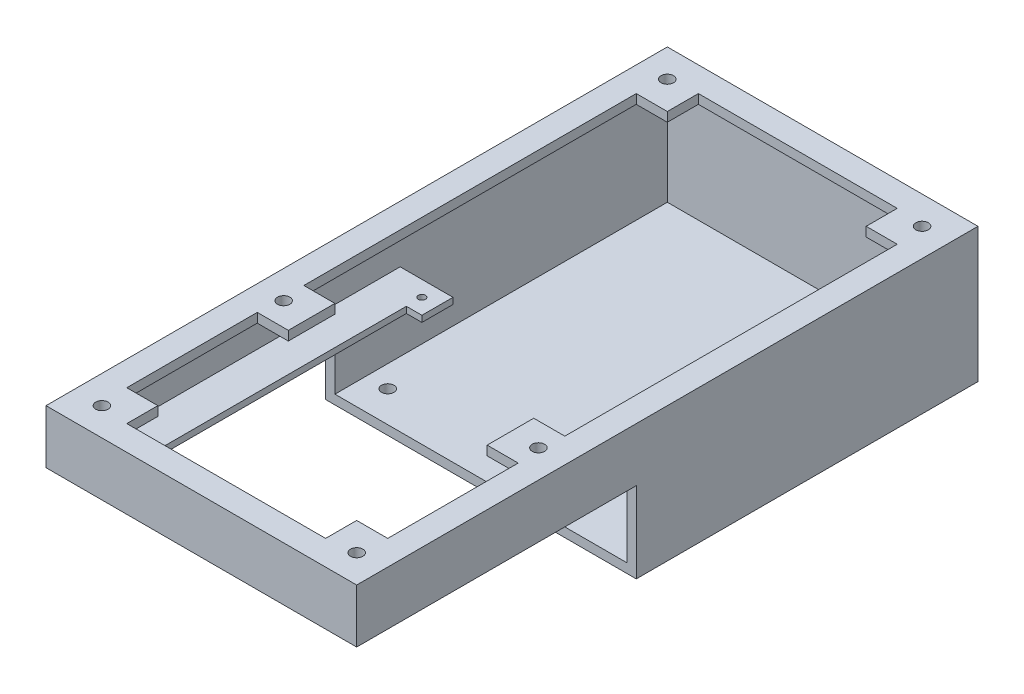
from build123d import *

# Parameters (mm, degrees)
SKETCH1_W           = 100
SKETCH1_H           = 200
SKETCH1_W_2         = 67
SKETCH1_H_2         = 110
BOSS_EXTRUDE1_DEPTH = 2
SKETCH2_W           = 100
SKETCH2_H           = 200
SKETCH2_W_2         = 94
SKETCH2_H_2         = 194
BOSS_EXTRUDE2_DEPTH = 16.4
SKETCH3_R           = 1.15
BOSS_EXTRUDE3_DEPTH = 2
BOSS_EXTRUDE4_DEPTH = 25
SKETCH8_W           = 100
SKETCH8_H           = 110
BOSS_EXTRUDE5_DEPTH = 3
SKETCH9_W           = 11
SKETCH9_H           = 13
CUT_EXTRUDE2_DEPTH  = 36
SKETCH13_W          = 141.504865249
SKETCH13_H          = 212.967188503
CUT_EXTRUDE6_DEPTH  = 3.1
SKETCH14_W          = 94
SKETCH14_H          = 194
BOSS_EXTRUDE6_DEPTH = 3
CUT_EXTRUDE7_DEPTH  = 3
SKETCH15_R          = 2
CUT_EXTRUDE8_DEPTH  = 3
SKETCH16_R          = 2
CUT_EXTRUDE9_DEPTH  = 3
SKETCH17_R          = 2
CUT_EXTRUDE10_DEPTH = 3


with BuildPart() as part:
    # Sketch1 → Boss-Extrude1 (new body)
    with BuildSketch(Plane(origin=(0, 0, 0), x_dir=(1, 0, 0), z_dir=(0, 1, 0))):
        Rectangle(SKETCH1_W, SKETCH1_H)
        with Locations((0, 35)):
            Rectangle(SKETCH1_W_2, SKETCH1_H_2, mode=Mode.SUBTRACT)
    extrude(amount=BOSS_EXTRUDE1_DEPTH)

    # Sketch2 → Boss-Extrude2 (add)
    with BuildSketch(Plane.XZ):
        Rectangle(SKETCH2_W, SKETCH2_H)
        Rectangle(SKETCH2_W_2, SKETCH2_H_2, mode=Mode.SUBTRACT)
    extrude(amount=BOSS_EXTRUDE2_DEPTH)

    # Sketch3 → Boss-Extrude3 (add)
    with BuildSketch(Plane.XZ.offset(16.4)):
        Polygon((-50, 100), (50, 100), (50, 10), (50, -11), (30, -11), (30, -1), (35, -1), (35, 10), (35, 80), (-35, 80), (-35, 10), (-35, -1), (-30, -1), (-30, -11), (-50, -11), (-50, 10), align=None)
        with Locations((-35, 85)):
            Circle(SKETCH3_R, mode=Mode.SUBTRACT)
        with Locations((35, 85)):
            Circle(SKETCH3_R, mode=Mode.SUBTRACT)
        with Locations((-35, -6)):
            Circle(SKETCH3_R, mode=Mode.SUBTRACT)
        with Locations((35, -6)):
            Circle(SKETCH3_R, mode=Mode.SUBTRACT)
    extrude(amount=BOSS_EXTRUDE3_DEPTH)

    # Sketch5 → Boss-Extrude4 (add)
    with BuildSketch(Plane.XZ.offset(16.4)):
        Polygon((-50, -100), (50, -100), (50, -97), (50, 10), (47, 10), (47, -97), (-47, -97), (-47, 10), (-50, 10), (-50, -97), align=None)
    extrude(amount=BOSS_EXTRUDE4_DEPTH)

    # Sketch8 → Boss-Extrude5 (add)
    with BuildSketch(Plane.XZ.offset(41.4)):
        with Locations((0, -45)):
            Rectangle(SKETCH8_W, SKETCH8_H)
    extrude(amount=BOSS_EXTRUDE5_DEPTH)

    # Sketch9 → Cut-Extrude2 (cut)
    with BuildSketch(Plane(origin=(0, -16.4, 0), x_dir=(1, 0, 0), z_dir=(0, 1, 0))):
        with Locations((-28.65, -74.5)):
            Rectangle(SKETCH9_W, SKETCH9_H)
        with Locations((-0.71, -74.5)):
            Rectangle(SKETCH9_W, SKETCH9_H)
        with Locations((24.69, -74.5)):
            Rectangle(SKETCH9_W, SKETCH9_H)
        with Locations((-28.65, -49.1)):
            Rectangle(SKETCH9_W, SKETCH9_H)
        with Locations((-0.71, -49.1)):
            Rectangle(SKETCH9_W, SKETCH9_H)
        with Locations((24.69, -49.1)):
            Rectangle(SKETCH9_W, SKETCH9_H)
    extrude(amount=CUT_EXTRUDE2_DEPTH, mode=Mode.SUBTRACT)

    # Sketch13 → Cut-Extrude6 (cut)
    with BuildSketch(Plane(origin=(0, 2, 0), x_dir=(1, 0, 0), z_dir=(0, 1, 0))):
        with Locations((7.572166702, -0.236630209)):
            Rectangle(SKETCH13_W, SKETCH13_H)
    extrude(amount=-CUT_EXTRUDE6_DEPTH, mode=Mode.SUBTRACT)

    # Sketch14 → Boss-Extrude6 (add)
    with BuildSketch(Plane(origin=(0, -1.1, 0), x_dir=(1, 0, 0), z_dir=(0, 1, 0))):
        Rectangle(SKETCH14_W, SKETCH14_H)
    extrude(amount=-BOSS_EXTRUDE6_DEPTH)

    # Sketch14<4> → Cut-Extrude7 (cut)
    with BuildSketch(Plane(origin=(0, -1.1, 0), x_dir=(1, 0, 0), z_dir=(0, 1, 0))):
        Polygon((-32, 92), (32, 92), (32, 82), (42, 82), (42, -25), (32, -25), (32, -40), (42, -40), (42, -82), (32, -82), (32, -92), (-32, -92), (-32, -82), (-42, -82), (-42, -40), (-32, -40), (-32, -25), (-42, -25), (-42, 82), (-32, 82), align=None)
    extrude(amount=-CUT_EXTRUDE7_DEPTH, mode=Mode.SUBTRACT)

    # Sketch15 → Cut-Extrude8 (cut)
    with BuildSketch(Plane.XZ.offset(44.4)):
        with Locations((-40, 0)):
            Circle(SKETCH15_R)
        with Locations((40, 0)):
            Circle(SKETCH15_R)
    extrude(amount=-CUT_EXTRUDE8_DEPTH, mode=Mode.SUBTRACT)

    # Sketch16 → Cut-Extrude9 (cut)
    with BuildSketch(Plane.XZ.offset(18.4)):
        with Locations((-40, 92.5)):
            Circle(SKETCH16_R)
        with Locations((40, 92.5)):
            Circle(SKETCH16_R)
    extrude(amount=-CUT_EXTRUDE9_DEPTH, mode=Mode.SUBTRACT)

    # Sketch17 → Cut-Extrude10 (cut)
    with BuildSketch(Plane(origin=(0, -1.1, 0), x_dir=(1, 0, 0), z_dir=(0, 1, 0))):
        with Locations((-41, 91)):
            Circle(SKETCH17_R)
        with Locations((41, 91)):
            Circle(SKETCH17_R)
        with Locations((-41, -32.5)):
            Circle(SKETCH17_R)
        with Locations((41, -32.5)):
            Circle(SKETCH17_R)
        with Locations((-41, -91)):
            Circle(SKETCH17_R)
        with Locations((41, -91)):
            Circle(SKETCH17_R)
    extrude(amount=-CUT_EXTRUDE10_DEPTH, mode=Mode.SUBTRACT)


solid = part.part
